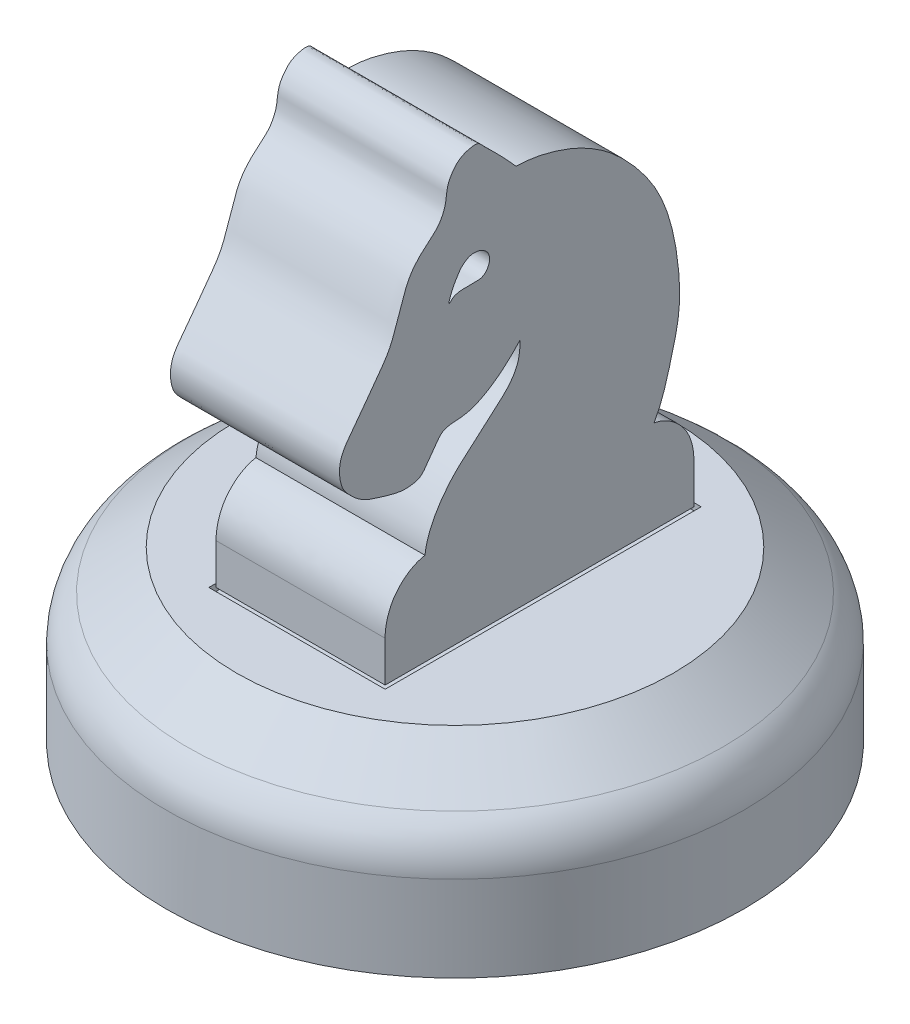
from build123d import *

# Parameters (mm, degrees)
SKETCH1_R                  = 16.271875
BOSS_EXTRUDE1_DEPTH        = 6.35
FILLET1_R                  = 3.175
SKETCH3_W                  = 12.9032
SKETCH3_H                  = 19.2532
CUT_EXTRUDE1_DEPTH         = 4.7625
F_6_0_204_DIAMETER_HOLE1_D = 5.1816
BOSS_EXTRUDE2_DEPTH        = 4.7625
SKETCH7_W                  = 9.9314
SKETCH7_H                  = 17.8054
CUT_EXTRUDE2_DEPTH         = 0.396875


with BuildPart() as part:
    # Sketch1 → Boss-Extrude1 (new body)
    with BuildSketch(Plane(origin=(0, 0, 0), x_dir=(1, 0, 0), z_dir=(0, 1, 0))):
        with Locations(Location((0, 0, 0), (0, 0, 270))):
            Circle(SKETCH1_R)
    extrude(amount=BOSS_EXTRUDE1_DEPTH)

    # Sketch2 → Revolve1 (revolve)
    with BuildSketch(Plane.XY, mode=Mode.PRIVATE) as revolve1_sk:
        Polygon((-16.271875, 6.35), (-12.303125, 9.525), (0, 9.525), (0, 6.35), align=None)
    revolve(revolve1_sk.sketch.rotate(Axis((0, 9.525, 0), (0, -1, 0)), 270), axis=Axis((0, 9.525, 0), (0, -1, 0)))

    # Fillet1
    fillet1_edges = [part.edges().sort_by_distance(p)[0] for p in [
        (0, 6.35, -16.271875),
    ]]
    fillet(fillet1_edges, radius=FILLET1_R)

    # Sketch3 → Cut-Extrude1 (cut)
    with BuildSketch(Plane.XZ):
        Rectangle(SKETCH3_W, SKETCH3_H)
    extrude(amount=-CUT_EXTRUDE1_DEPTH, mode=Mode.SUBTRACT)

    # #6 (0.204) Diameter Hole1 (through all)
    with Locations(Plane(origin=(0, 4.7625, 0), x_dir=(-1, 0, 0), z_dir=(0, -1, 0))):
        with Locations((0, 0)):
            Hole(F_6_0_204_DIAMETER_HOLE1_D / 2)

    # Sketch7 → Cut-Extrude2 (cut)
    with BuildSketch(Plane(origin=(0, 9.525, 0), x_dir=(1, 0, 0), z_dir=(0, 1, 0))):
        Rectangle(SKETCH7_W, SKETCH7_H)
    extrude(amount=-CUT_EXTRUDE2_DEPTH, mode=Mode.SUBTRACT)


with BuildPart() as body_2:
    # Sketch6 → Boss-Extrude2 (new, symmetric)
    with BuildSketch(Plane(origin=(0, 0, 0), x_dir=(0, 0, -1), z_dir=(1, 0, 0))):
        with BuildLine():
            Line((-8.6995, 9.525), (8.6995, 9.525))
            Line((8.6995, 9.525), (8.6995, 11.811))
            add(Edge.make_bspline(
                [(8.6995, 11.811), (8.6995, 11.981596192), (8.672682122, 12.366402891), (8.528548662, 12.906477559), (8.283860652, 13.451955457), (7.704891671, 14.208750478), (7.021562794, 14.640334761), (6.455151202, 14.737953783)],
                knots=[0, 0, 0, 0, 0.12823399, 0.288855326, 0.417856801, 0.575529243, 1, 1, 1, 1], degree=3))
            add(Edge.make_bspline(
                [(-1.317860957, 31.148797323), (-0.631432852, 31.143107605), (0.61502231, 30.91707366), (2.421093823, 30.241877627), (4.021089039, 29.22023583), (5.379236033, 27.837520359), (6.418872292, 26.44369457), (7.115551218, 24.986345257), (7.567232468, 23.451893458), (7.866457509, 21.577285539), (7.965991478, 19.44808116), (7.34079514, 17.110101974), (6.907262012, 15.534791602), (6.455151202, 14.737953783)],
                knots=[0, 0, 0, 0, 0.095317006, 0.175052084, 0.267210487, 0.356913668, 0.443609027, 0.508026404, 0.580719545, 0.665406679, 0.772327532, 0.873992627, 1, 1, 1, 1], degree=3))
            add(Edge.make_bspline(
                [(-1.106116625, 22.554226092), (-1.524241912, 22.095248332), (-2.157634698, 21.489506835), (-3.087918125, 20.892748905), (-3.754463046, 20.565854145), (-4.450323035, 20.42413546), (-5.021989126, 20.424564374), (-5.50734482, 20.286373493), (-5.773972637, 19.943976096), (-6.031152029, 19.588865713), (-6.251398045, 19.276534867), (-6.447186499, 18.978482742), (-6.625219926, 18.768858385), (-6.843074318, 18.620342437), (-7.260913116, 18.516764469), (-7.740677885, 18.508089264), (-8.389001273, 18.653276271), (-8.997993874, 18.825893033), (-9.716087702, 19.053361222), (-10.283490406, 19.393674798), (-10.730790444, 19.821232444), (-11.074187267, 20.221841559), (-11.2884547, 20.898981907), (-11.309327349, 21.86930397), (-10.67008222, 22.714620335), (-9.955938364, 23.643382227), (-9.277699626, 24.606951202), (-8.472930693, 25.657634566), (-8.07860489, 26.744716077), (-7.753263632, 27.678373187), (-7.491969725, 28.459160135), (-7.135009865, 29.069410415), (-6.666562395, 29.584477493), (-6.1319826, 30.023383722), (-5.696069191, 30.412067945), (-5.465261607, 30.825463482), (-5.283051108, 31.265301428), (-5.249264149, 31.777830832), (-5.133716881, 32.323321454), (-4.852824669, 32.739737642), (-4.561879232, 33.071474499), (-4.224181159, 33.2406253), (-3.859698322, 33.34605958), (-3.45651905, 33.39181193), (-3.182614602, 33.071899585), (-2.891656769, 32.798795258), (-2.520922412, 32.419644087), (-2.122542584, 32.033925138), (-1.719450649, 31.591648365), (-1.457300498, 31.301953935), (-1.317860957, 31.148797323)],
                knots=[0, 0, 0, 0, 0.060185165, 0.083943669, 0.106742747, 0.131602442, 0.151699746, 0.162138405, 0.178973695, 0.191699122, 0.205011607, 0.215804446, 0.226254319, 0.231332103, 0.241037408, 0.267259263, 0.276935409, 0.305211694, 0.328527441, 0.349561142, 0.368396546, 0.388495295, 0.399372531, 0.436694338, 0.476526125, 0.498152822, 0.550636672, 0.590475565, 0.625186996, 0.661565154, 0.68642436, 0.704515784, 0.729531775, 0.753201058, 0.771644701, 0.785337289, 0.798628666, 0.817298586, 0.834697798, 0.851764591, 0.865242336, 0.876940805, 0.887382039, 0.902945208, 0.911137807, 0.926285054, 0.942165232, 0.962198687, 0.979971499, 1, 1, 1, 1], degree=3))
            add(Edge.make_bspline(
                [(-6.455151202, 14.737953783), (-6.38371772, 15.367119328), (-5.887374624, 16.614824068), (-4.842812152, 17.897225542), (-3.660846653, 18.894042909), (-2.779319152, 19.692352114), (-1.940382894, 20.393996839), (-1.475958465, 20.978116647), (-1.126388931, 21.649646896), (-1.096489648, 22.21312538), (-1.106116625, 22.554226092)],
                knots=[0, 0, 0, 0, 0.192258097, 0.405859207, 0.498919055, 0.666224408, 0.770847742, 0.832929755, 0.89402925, 1, 1, 1, 1], degree=3))
            add(Edge.make_bspline(
                [(-8.6995, 11.811), (-8.6995, 11.981596192), (-8.672682122, 12.366402891), (-8.528548662, 12.906477559), (-8.283860652, 13.451955457), (-7.704891671, 14.208750478), (-7.021562794, 14.640334761), (-6.455151202, 14.737953783)],
                knots=[0, 0, 0, 0, 0.12823399, 0.288855326, 0.417856801, 0.575529243, 1, 1, 1, 1], degree=3))
            Line((-8.6995, 11.811), (-8.6995, 9.525))
        make_face()
        with BuildLine():
            add(Edge.make_bspline(
                [(-5.086170176, 26.338898877), (-5.051858163, 26.348399576), (-4.932714666, 26.483104508), (-4.748345062, 26.58403004), (-4.429672933, 26.66287988), (-4.023957657, 26.641256764), (-3.633952031, 26.646061924), (-3.322760745, 26.65681124), (-3.086886085, 26.771747442), (-2.935797719, 26.960427395), (-2.826679408, 27.167136372), (-2.801132119, 27.411587188), (-2.853074863, 27.653781109), (-3.000660304, 27.842911457), (-3.176773406, 27.988802374), (-3.39949872, 28.078996318), (-3.651273774, 28.116463777), (-3.94412895, 28.089703497), (-4.210992398, 27.933754678), (-4.444994106, 27.727868251), (-4.618457096, 27.460033775), (-4.816238927, 27.134583827), (-4.955700504, 26.849307341), (-5.151300425, 26.320864874), (-5.086170176, 26.338898877)],
                knots=[0, 0, 0, 0, 0.037676146, 0.05551634, 0.103904133, 0.184310142, 0.245367846, 0.285824882, 0.32829946, 0.36229477, 0.397084061, 0.435791871, 0.474404445, 0.509262158, 0.545392071, 0.579953508, 0.619659858, 0.66336188, 0.713892917, 0.760702485, 0.807081635, 0.863624654, 0.928484033, 1, 1, 1, 1], degree=3))
        make_face(mode=Mode.SUBTRACT)
    extrude(amount=BOSS_EXTRUDE2_DEPTH, both=True)


solid = Compound([part.part, body_2.part])
